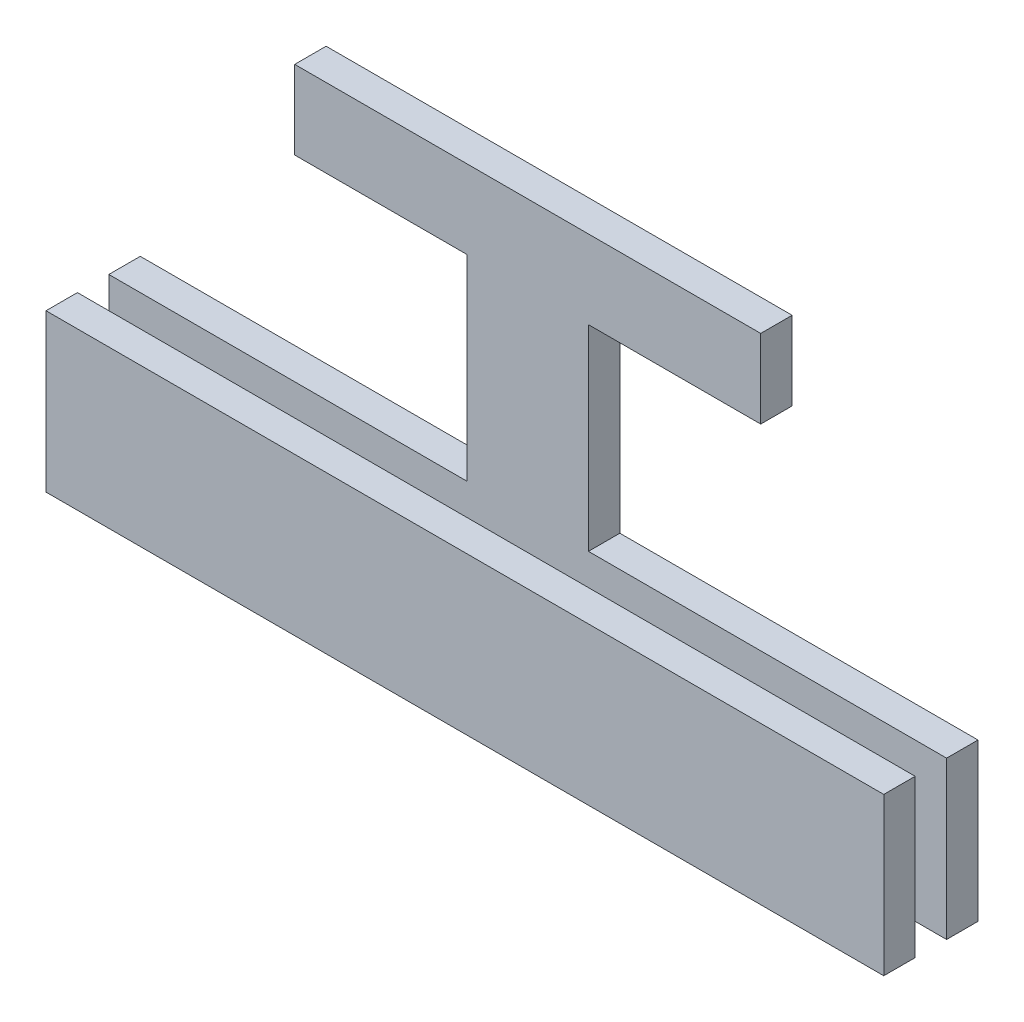
from build123d import *

# Parameters (mm, degrees)
SKETCH1_W           = 80
SKETCH1_H           = 15
BOSS_EXTRUDE1_DEPTH = 3
BOSS_EXTRUDE2_DEPTH = 3


with BuildPart() as part:
    # Sketch1 → Boss-Extrude1 (new body)
    with BuildSketch(Plane.XY):
        Rectangle(SKETCH1_W, SKETCH1_H)
    extrude(amount=BOSS_EXTRUDE1_DEPTH)


with BuildPart() as body_2:
    # Sketch3 → Boss-Extrude2 (new body)
    with BuildSketch(Plane(origin=(0, 0, -3), x_dir=(-1, 0, 0), z_dir=(0, 0, -1))):
        Polygon((40, -7.5), (-40, -7.5), (-40, 7.5), (-5.8, 7.5), (-5.8, 26.25), (-22.25, 26.25), (-22.25, 33.75), (22.25, 33.75), (22.25, 26.25), (5.8, 26.25), (5.8, 7.5), (40, 7.5), align=None)
    extrude(amount=BOSS_EXTRUDE2_DEPTH)


solid = Compound([part.part, body_2.part])
